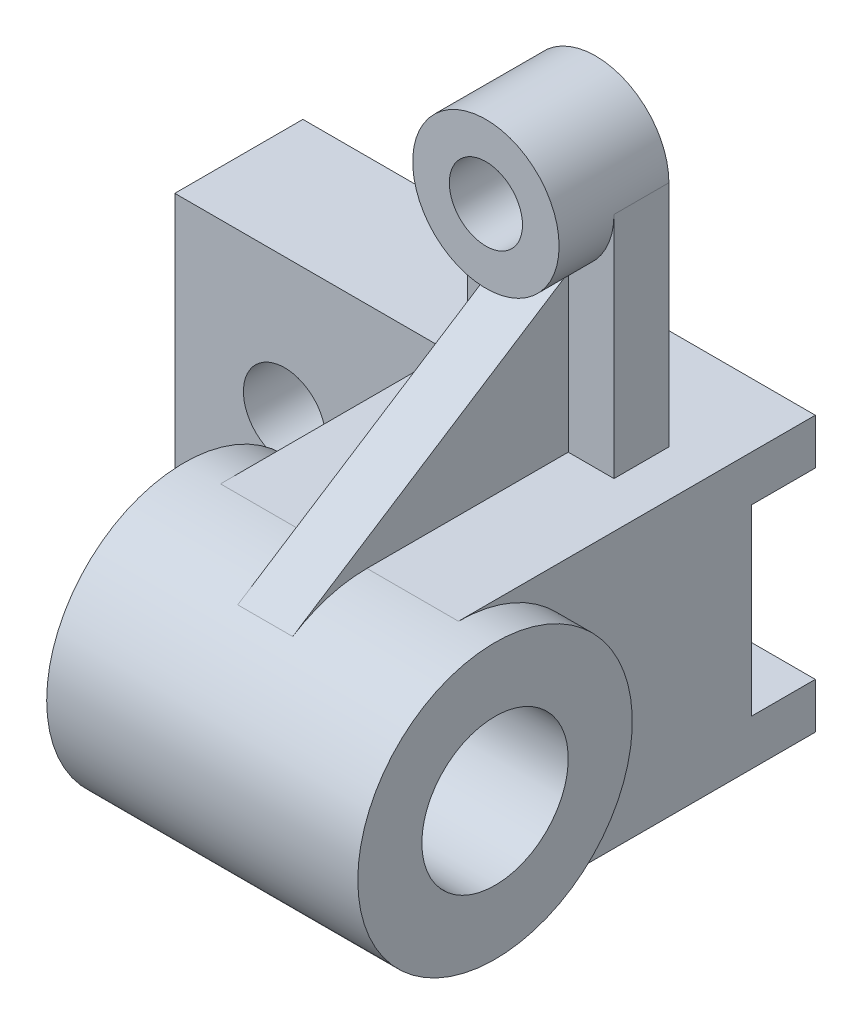
from build123d import *

# Parameters (mm, degrees)
SKETCH1_W                = 112
SKETCH1_H                = 60
BOSS_EXTRUDE1_DEPTH      = 28
SKETCH2_W                = 14
SKETCH2_H                = 40
CUT_EXTRUDE1_DEPTH       = 120.28118041
SKETCH3_W                = 52
SKETCH3_H                = 60
BOSS_EXTRUDE2_DEPTH      = 50
BOSS_EXTRUDE3_DEPTH      = 8
BOSS_EXTRUDE3_DEPTH_BACK = 60
SKETCH4_R                = 30
SKETCH4_R_2              = 16
SKETCH5_R                = 16
CUT_EXTRUDE2_DEPTH       = 105.403065089
SKETCH6_W                = 32
SKETCH6_H                = 12
BOSS_EXTRUDE4_DEPTH      = 50
BOSS_EXTRUDE5_DEPTH      = 12
BOSS_EXTRUDE5_DEPTH_BACK = 12
SKETCH8_R                = 16
SKETCH8_R_2              = 8
SKETCH9_R                = 8
CUT_EXTRUDE3_DEPTH       = 138.069325525
RIB1_REACH               = 153.697
SKETCH17_WALL_W          = 377.032111856
SKETCH17_WALL_H          = 12
SKETCH18_R               = 9
CUT_EXTRUDE4_DEPTH       = 141.399430198


with BuildPart() as part:
    # Sketch1 → Boss-Extrude1 (new body)
    with BuildSketch(Plane.XY):
        Rectangle(SKETCH1_W, SKETCH1_H)
    extrude(amount=-BOSS_EXTRUDE1_DEPTH)

    # Sketch2 → Cut-Extrude1 (cut, through all)
    with BuildSketch(Plane(origin=(56, 0, 0), x_dir=(0, 0, -1), z_dir=(1, 0, 0))):
        with Locations((21, 0)):
            Rectangle(SKETCH2_W, SKETCH2_H)
    extrude(amount=-CUT_EXTRUDE1_DEPTH, mode=Mode.SUBTRACT)

    # Sketch3 → Boss-Extrude2 (add)
    with BuildSketch(Plane.XY):
        with Locations((30, 0)):
            Rectangle(SKETCH3_W, SKETCH3_H)
    extrude(amount=BOSS_EXTRUDE2_DEPTH)

    # Sketch4 → Boss-Extrude3 (add, two sides: drawn at the far end of the back side and taken through both)
    with BuildSketch(Plane.ZY.offset(-4).offset(-BOSS_EXTRUDE3_DEPTH_BACK)):
        with Locations((50, 0)):
            Circle(SKETCH4_R)
        with Locations((50, 0)):
            Circle(SKETCH4_R_2, mode=Mode.SUBTRACT)
    extrude(amount=BOSS_EXTRUDE3_DEPTH + BOSS_EXTRUDE3_DEPTH_BACK)

    # Sketch5 → Cut-Extrude2 (cut, through all)
    with BuildSketch(Plane.ZY.offset(-4)):
        with Locations((50, 0)):
            Circle(SKETCH5_R)
    extrude(amount=-CUT_EXTRUDE2_DEPTH, mode=Mode.SUBTRACT)

    # Sketch6 → Boss-Extrude4 (add)
    with BuildSketch(Plane(origin=(0, 30, 0), x_dir=(1, 0, 0), z_dir=(0, 1, 0))):
        with Locations((30, 0)):
            Rectangle(SKETCH6_W, SKETCH6_H)
    extrude(amount=BOSS_EXTRUDE4_DEPTH)

    # Sketch8 → Boss-Extrude5 (add, two sides: drawn at the far end of the back side and taken through both)
    with BuildSketch(Plane.XY.offset(6).offset(-BOSS_EXTRUDE5_DEPTH_BACK)):
        with Locations((30, 80)):
            Circle(SKETCH8_R)
        with Locations((30, 80)):
            Circle(SKETCH8_R_2, mode=Mode.SUBTRACT)
    extrude(amount=BOSS_EXTRUDE5_DEPTH + BOSS_EXTRUDE5_DEPTH_BACK)

    # Sketch9 → Cut-Extrude3 (cut, through all)
    with BuildSketch(Plane.XY.offset(6)):
        with Locations((30, 80)):
            Circle(SKETCH9_R)
    extrude(amount=-CUT_EXTRUDE3_DEPTH, mode=Mode.SUBTRACT)

    # Sketch17 wall → Rib1 (add, up to next)
    with BuildSketch(Plane(origin=(30, 44.612908816, 36.118776459), x_dir=(0, -0.541251763971, 0.84086058773), z_dir=(0, -0.84086058773, -0.541251763971)), mode=Mode.PRIVATE) as rib1_sk1:
        Rectangle(SKETCH17_WALL_W, SKETCH17_WALL_H)
    rib1_tool1 = extrude(rib1_sk1.sketch, amount=RIB1_REACH, mode=Mode.PRIVATE) - part.part
    add(rib1_tool1.solids().sort_by_distance((30, 44.612908816, 36.118776459))[0])

    # Sketch18 → Cut-Extrude4 (cut, through all)
    with BuildSketch(Plane.XY):
        with Locations((-32, 0)):
            Circle(SKETCH18_R)
    extrude(amount=-CUT_EXTRUDE4_DEPTH, mode=Mode.SUBTRACT)


solid = part.part
